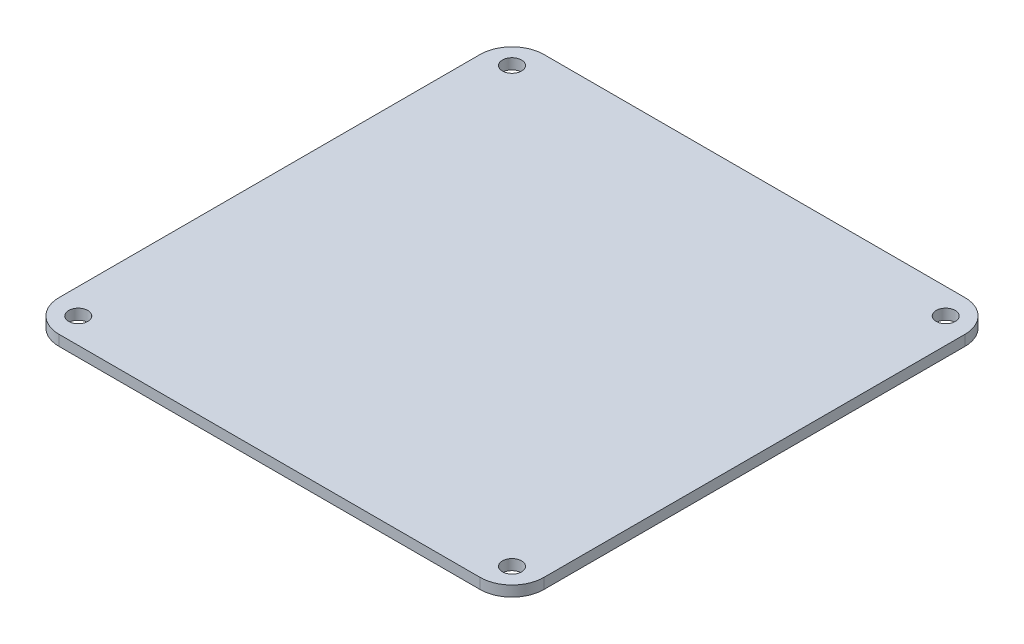
from build123d import *

# Parameters (mm, degrees)
SKETCH_1_R      = 1.5
EXTRUDE_1_DEPTH = 1.65


with BuildPart() as part:
    # 草图1 → 凸台-拉伸1 (new body)
    with BuildSketch(Plane(origin=(0, 0, 0), x_dir=(1, 0, 0), z_dir=(0, 1, 0))):
        with BuildLine():
            Line((-33, -38), (33, -38))
            ThreePointArc((33, -38), (36.535533906, -36.535533906), (38, -33))
            Line((38, -33), (38, 33))
            ThreePointArc((38, 33), (36.535533906, 36.535533906), (33, 38))
            Line((33, 38), (-33, 38))
            ThreePointArc((-33, 38), (-36.535533906, 36.535533906), (-38, 33))
            Line((-38, 33), (-38, -33))
            ThreePointArc((-38, -33), (-36.535533906, -36.535533906), (-33, -38))
        make_face()
        with Locations(Location((-34, -34, 0), (0, 0, 270))):
            Circle(SKETCH_1_R, mode=Mode.SUBTRACT)
        with Locations(Location((34, -34, 0), (0, 0, 270))):
            Circle(SKETCH_1_R, mode=Mode.SUBTRACT)
        with Locations(Location((-34, 34, 0), (0, 0, 270))):
            Circle(SKETCH_1_R, mode=Mode.SUBTRACT)
        with Locations(Location((34, 34, 0), (0, 0, 270))):
            Circle(SKETCH_1_R, mode=Mode.SUBTRACT)
    extrude(amount=EXTRUDE_1_DEPTH)


solid = part.part
